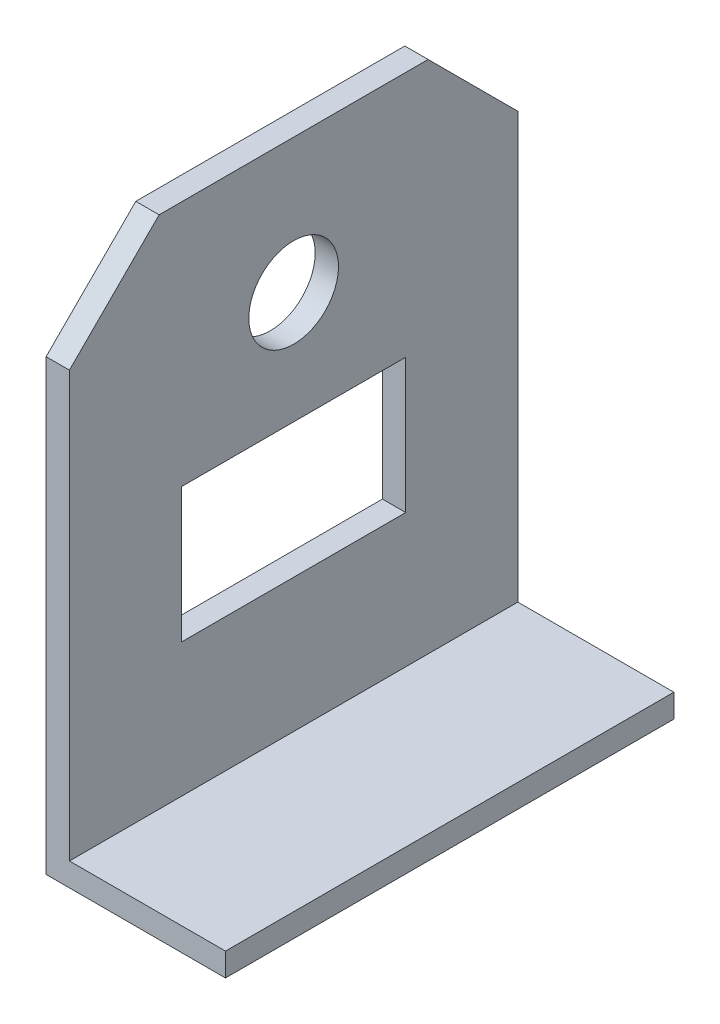
from build123d import *

# Parameters (mm, degrees)
BOSS_EXTRUDE1_DEPTH = 31.75
SKETCH5_R           = 6.35
SKETCH5_W           = 31.75
SKETCH5_H           = 19.05
CUT_EXTRUDE1_DEPTH  = 3.302


with BuildPart() as part:
    # Sketch4 → Boss-Extrude1 (new, symmetric)
    with BuildSketch(Plane.XY):
        Polygon((0, 0), (0, 76.2), (3.302, 76.2), (3.302, 3.302), (25.4, 3.302), (25.4, 0), align=None)
    extrude(amount=BOSS_EXTRUDE1_DEPTH, both=True)

    # Sketch5 → Cut-Extrude1 (cut)
    with BuildSketch(Plane(origin=(3.302, 0, 0), x_dir=(0, 0, -1), z_dir=(1, 0, 0))):
        with Locations(Location((0, 57.15, 0), (0, 0, 90))):
            Circle(SKETCH5_R)
        Polygon((-31.75, 63.5), (-31.75, 76.2), (-19.05, 76.2), align=None)
        with Locations((0, 31.75)):
            Rectangle(SKETCH5_W, SKETCH5_H)
        Polygon((19.05, 76.2), (31.75, 63.5), (31.75, 76.2), align=None)
    extrude(amount=-CUT_EXTRUDE1_DEPTH, mode=Mode.SUBTRACT)


solid = part.part
